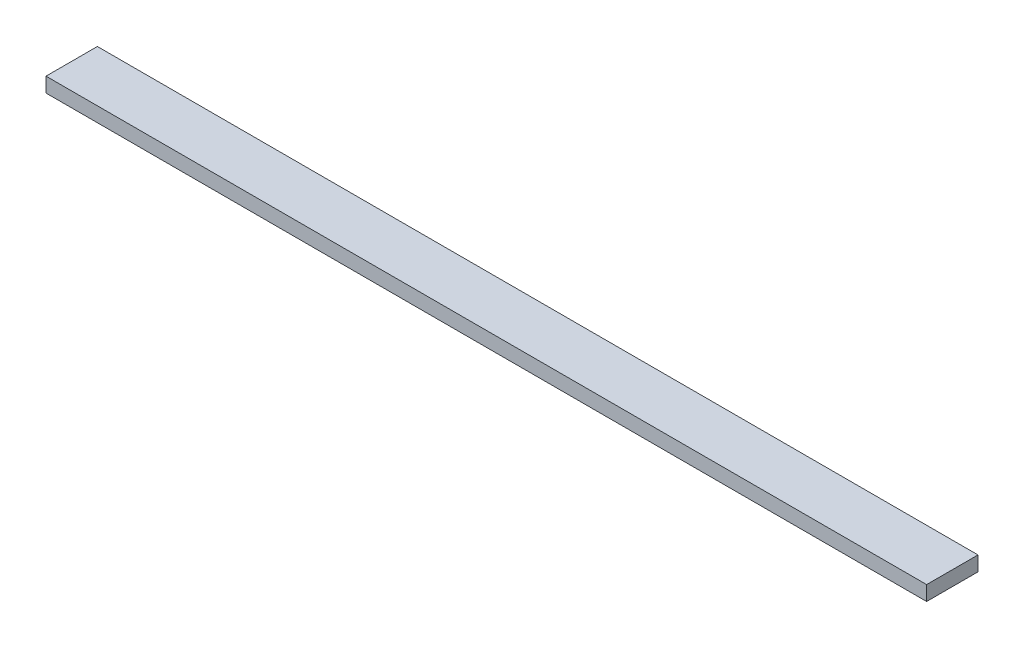
from build123d import *

# Parameters (mm, degrees)
SKETCH1_W           = 600
SKETCH1_H           = 35
BOSS_EXTRUDE1_DEPTH = 10


with BuildPart() as part:
    # Sketch1 → Boss-Extrude1 (new body)
    with BuildSketch(Plane(origin=(0, 0, 0), x_dir=(1, 0, 0), z_dir=(0, 1, 0))):
        with Locations((300, -17.5)):
            Rectangle(SKETCH1_W, SKETCH1_H)
    extrude(amount=BOSS_EXTRUDE1_DEPTH)


solid = part.part
